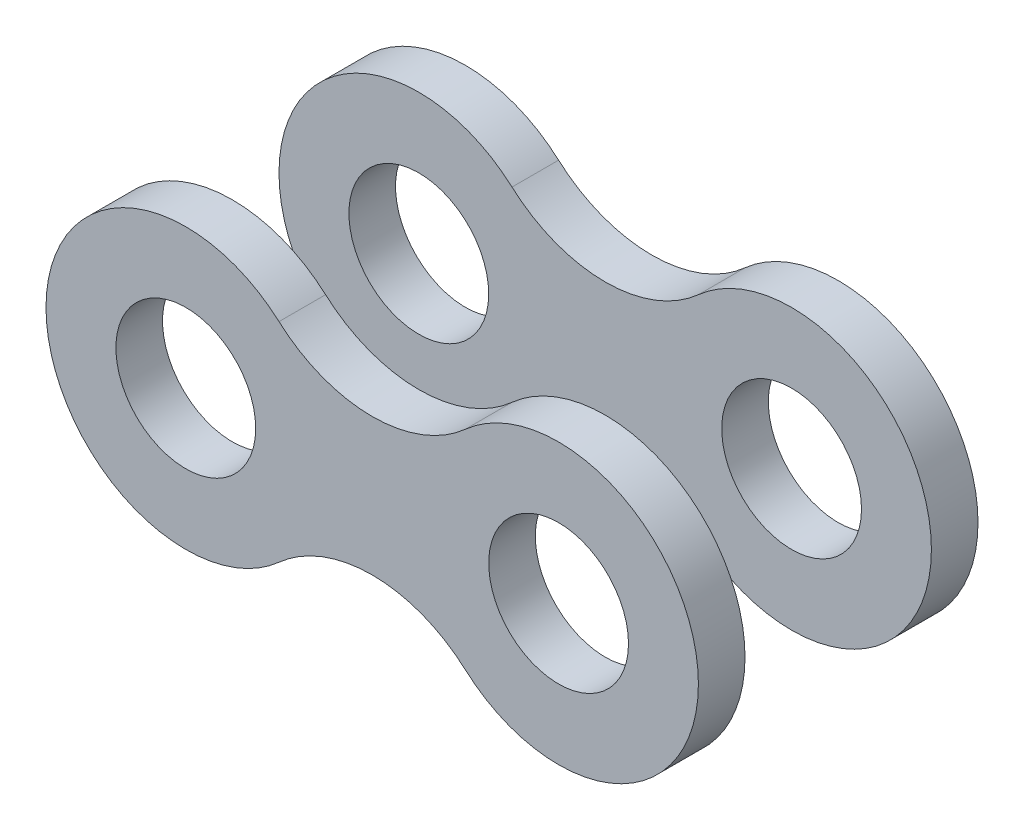
from build123d import *

# Parameters (mm, degrees)
SKETCH2_R           = 2.38125
SKETCH2_R_2         = 1.190625
BOSS_EXTRUDE1_DEPTH = 0.79375
SKETCH3_R           = 2.69875
SKETCH3_R_2         = 1.190625
BOSS_EXTRUDE2_DEPTH = 0.79375
BOSS_EXTRUDE3_START = 0.79375
SKETCH3_4_R         = 1.190625
BOSS_EXTRUDE3_DEPTH = 3.175


with BuildPart() as part:
    # Sketch2 → Boss-Extrude1 (new body)
    # profile 1 of 3: a face of its own
    with BuildSketch(Plane.XY):
        Circle(SKETCH2_R)
        Circle(SKETCH2_R_2, mode=Mode.SUBTRACT)
    # profile 2 of 3: a face of its own
    with BuildSketch(Plane.XY):
        with BuildLine():
            ThreePointArc((1.5875, 1.774878957), (2.1737739, 0.972141242), (2.38125, 0))
            ThreePointArc((2.38125, 0), (2.1737739, -0.972141242), (1.5875, -1.774878957))
            ThreePointArc((1.5875, -1.774878957), (3.175, -1.168507914), (4.7625, -1.774878957))
            ThreePointArc((4.7625, -1.774878957), (3.96875, 0), (4.7625, 1.774878957))
            ThreePointArc((4.7625, 1.774878957), (3.175, 1.168507914), (1.5875, 1.774878957))
        make_face()
    # profile 3 of 3: a face of its own
    with BuildSketch(Plane.XY):
        with Locations((6.35, 0)):
            Circle(SKETCH2_R)
        with Locations((6.35, 0)):
            Circle(SKETCH2_R_2, mode=Mode.SUBTRACT)
    extrude(amount=BOSS_EXTRUDE1_DEPTH)


with BuildPart() as body_2:
    # Sketch3 → Boss-Extrude2 (new body)
    # profile 1 of 4: a face of its own
    with BuildSketch(Plane(origin=(0, 0, 0), x_dir=(-1, 0, 0), z_dir=(0, 0, -1))):
        with Locations((-12.7, 0)):
            Circle(SKETCH3_R)
        with Locations((-12.7, 0)):
            Circle(SKETCH3_R_2, mode=Mode.SUBTRACT)
    # profile 2 of 4: a face of its own
    with BuildSketch(Plane(origin=(0, 0, 0), x_dir=(-1, 0, 0), z_dir=(0, 0, -1))):
        with BuildLine():
            ThreePointArc((-3.65125, 0), (-3.737895814, 0.678353361), (-3.99226957, 1.313148424))
            ThreePointArc((-3.99226957, 1.313148424), (-4.399347966, 1.507376065), (-4.7625, 1.774878957))
            ThreePointArc((-4.7625, 1.774878957), (-8.73125, 0), (-4.7625, -1.774878957))
            ThreePointArc((-4.7625, -1.774878957), (-4.399347966, -1.507376065), (-3.99226957, -1.313148424))
            ThreePointArc((-3.99226957, -1.313148424), (-3.737895814, -0.678353361), (-3.65125, 0))
        make_face()
        with Locations(Location((-6.35, 0, 0), (0, 0, 180))):
            Circle(SKETCH3_R_2, mode=Mode.SUBTRACT)
    # profile 3 of 4: a face of its own
    with BuildSketch(Plane(origin=(0, 0, 0), x_dir=(-1, 0, 0), z_dir=(0, 0, -1))):
        with BuildLine():
            ThreePointArc((-3.99226957, 1.313148424), (-5.769279961, 2.63552951), (-7.9375, 2.182451675))
            ThreePointArc((-7.9375, 2.182451675), (-9.04875, 0), (-7.9375, -2.182451675))
            ThreePointArc((-7.9375, -2.182451675), (-5.769279961, -2.63552951), (-3.99226957, -1.313148424))
            ThreePointArc((-3.99226957, -1.313148424), (-4.399347966, -1.507376065), (-4.7625, -1.774878957))
            ThreePointArc((-4.7625, -1.774878957), (-8.73125, 0), (-4.7625, 1.774878957))
            ThreePointArc((-4.7625, 1.774878957), (-4.399347966, 1.507376065), (-3.99226957, 1.313148424))
        make_face()
    # profile 4 of 4: a face of its own
    with BuildSketch(Plane(origin=(0, 0, 0), x_dir=(-1, 0, 0), z_dir=(0, 0, -1))):
        with BuildLine():
            ThreePointArc((-7.9375, -2.182451675), (-9.04875, 0), (-7.9375, 2.182451675))
            ThreePointArc((-7.9375, 2.182451675), (-9.525, 1.666153349), (-11.1125, 2.182451675))
            ThreePointArc((-11.1125, 2.182451675), (-10.295055387, 1.224537859), (-10.00125, 0))
            ThreePointArc((-10.00125, 0), (-10.295055387, -1.224537859), (-11.1125, -2.182451675))
            ThreePointArc((-11.1125, -2.182451675), (-9.525, -1.666153349), (-7.9375, -2.182451675))
        make_face()
    extrude(amount=BOSS_EXTRUDE2_DEPTH)

    # Sketch3<4> → Boss-Extrude3 (add)
    with BuildSketch(Plane(origin=(0, 0, 0), x_dir=(-1, 0, 0), z_dir=(0, 0, -1)).offset(BOSS_EXTRUDE3_START)):
        with Locations(Location((-6.35, 0, 0), (0, 0, 180))):
            Circle(SKETCH3_4_R)
        with Locations((-12.7, 0)):
            Circle(SKETCH3_4_R)
    extrude(amount=-BOSS_EXTRUDE3_DEPTH)


with BuildPart() as body_3:
    # Mirror1: mirrored copy
    add(body_2.part.mirror(Plane(origin=(6.35, 0, 2.38125), x_dir=(1, 0, 0), z_dir=(0, 0, -1))))


with BuildPart() as body_4:
    # Mirror1 2: mirrored copy
    add(part.part.mirror(Plane(origin=(6.35, 0, 2.38125), x_dir=(1, 0, 0), z_dir=(0, 0, -1))))


with BuildPart() as body_2_1:
    add(body_2.part)

    # Combine1: union body 3
    add(body_3.part)


solid = Compound([part.part, body_4.part])
